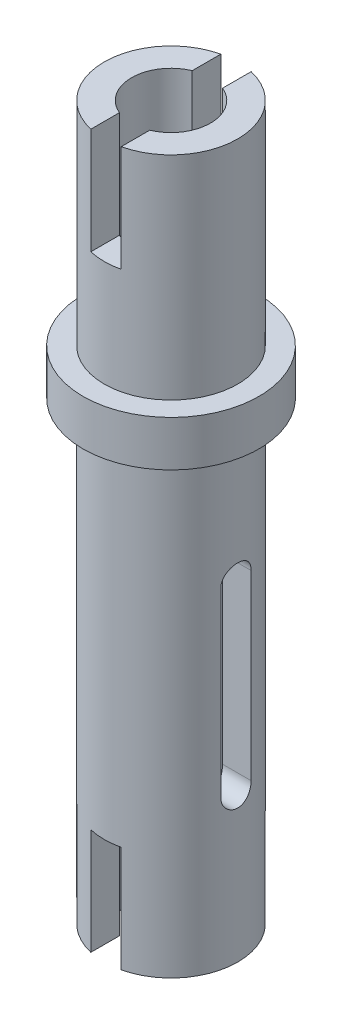
from build123d import *

# Parameters (mm, degrees)
SKETCH1_R           = 2.2
SKETCH1_R_2         = 1.3
BOSS_EXTRUDE1_DEPTH = 23.5
BOSS_EXTRUDE2_START = -1.5
SKETCH2_R           = 2.9
SKETCH2_R_2         = 2.2
BOSS_EXTRUDE2_DEPTH = 1.5
CUT_EXTRUDE1_START  = -3.5
CUT_EXTRUDE1_DEPTH  = 3.5
CUT_EXTRUDE2_DEPTH  = 3.5
CUT_EXTRUDE3_DEPTH  = 11.75


with BuildPart() as part:
    # Sketch1 → Boss-Extrude1 (new body)
    with BuildSketch(Plane(origin=(0, 0, 0), x_dir=(1, 0, 0), z_dir=(0, 1, 0))):
        with Locations(Location((0, 0, 0), (0, 0, 270))):
            Circle(SKETCH1_R)
        with Locations(Location((0, 0, 0), (0, 0, 270))):
            Circle(SKETCH1_R_2, mode=Mode.SUBTRACT)
    extrude(amount=BOSS_EXTRUDE1_DEPTH)

    # Sketch2 → Boss-Extrude2 (add)
    with BuildSketch(Plane(origin=(0, 16.5, 0), x_dir=(1, 0, 0), z_dir=(0, 1, 0)).offset(BOSS_EXTRUDE2_START)):
        with Locations(Location((0, 0, 0), (0, 0, 270))):
            Circle(SKETCH2_R)
        with Locations(Location((0, 0, 0), (0, 0, 270))):
            Circle(SKETCH2_R_2, mode=Mode.SUBTRACT)
    extrude(amount=BOSS_EXTRUDE2_DEPTH)

    # Sketch4 → Cut-Extrude1 (cut)
    with BuildSketch(Plane(origin=(0, 23.5, 0), x_dir=(1, 0, 0), z_dir=(0, 1, 0)).offset(CUT_EXTRUDE1_START)):
        with BuildLine():
            Line((-0.5, -1.2), (-0.5, -2.142428529))
            ThreePointArc((-0.5, -2.142428529), (0, -2.2), (0.5, -2.142428529))
            Line((0.5, -2.142428529), (0.5, -1.2))
            ThreePointArc((0.5, -1.2), (0, -1.3), (-0.5, -1.2))
        make_face()
        with BuildLine():
            ThreePointArc((0.5, 2.142428529), (0, 2.2), (-0.5, 2.142428529))
            Line((-0.5, 2.142428529), (-0.5, 1.2))
            ThreePointArc((-0.5, 1.2), (0, 1.3), (0.5, 1.2))
            Line((0.5, 1.2), (0.5, 2.142428529))
        make_face()
        with BuildLine():
            Line((-0.5, -1.2), (-0.5, -2.142428529))
            ThreePointArc((-0.5, -2.142428529), (0, -2.2), (0.5, -2.142428529))
            Line((0.5, -2.142428529), (0.5, -1.2))
            ThreePointArc((0.5, -1.2), (0, -1.3), (-0.5, -1.2))
        make_face()
        with BuildLine():
            ThreePointArc((0.5, 2.142428529), (0, 2.2), (-0.5, 2.142428529))
            Line((-0.5, 2.142428529), (-0.5, 1.2))
            ThreePointArc((-0.5, 1.2), (0, 1.3), (0.5, 1.2))
            Line((0.5, 1.2), (0.5, 2.142428529))
        make_face()
    extrude(amount=CUT_EXTRUDE1_DEPTH, mode=Mode.SUBTRACT)

    # Sketch5 → Cut-Extrude2 (cut)
    with BuildSketch(Plane.XZ):
        with BuildLine():
            ThreePointArc((0.5, 2.142428529), (0, 2.2), (-0.5, 2.142428529))
            Line((-0.5, 2.142428529), (-0.5, 1.2))
            ThreePointArc((-0.5, 1.2), (0, 1.3), (0.5, 1.2))
            Line((0.5, 1.2), (0.5, 2.142428529))
        make_face()
        with BuildLine():
            Line((-0.5, -1.2), (-0.5, -2.142428529))
            ThreePointArc((-0.5, -2.142428529), (0, -2.2), (0.5, -2.142428529))
            Line((0.5, -2.142428529), (0.5, -1.2))
            ThreePointArc((0.5, -1.2), (0, -1.3), (-0.5, -1.2))
        make_face()
        with BuildLine():
            ThreePointArc((0.5, 2.142428529), (0, 2.2), (-0.5, 2.142428529))
            Line((-0.5, 2.142428529), (-0.5, 1.2))
            ThreePointArc((-0.5, 1.2), (0, 1.3), (0.5, 1.2))
            Line((0.5, 1.2), (0.5, 2.142428529))
        make_face()
        with BuildLine():
            Line((-0.5, -1.2), (-0.5, -2.142428529))
            ThreePointArc((-0.5, -2.142428529), (0, -2.2), (0.5, -2.142428529))
            Line((0.5, -2.142428529), (0.5, -1.2))
            ThreePointArc((0.5, -1.2), (0, -1.3), (-0.5, -1.2))
        make_face()
    extrude(amount=-CUT_EXTRUDE2_DEPTH, mode=Mode.SUBTRACT)

    # Sketch6 → Cut-Extrude3 (cut, symmetric)
    with BuildSketch(Plane(origin=(0, 0, 0), x_dir=(0, 0, -1), z_dir=(1, 0, 0))):
        with BuildLine():
            Line((0.5, 10.9), (0.5, 4.9))
            ThreePointArc((0.5, 4.9), (0, 4.4), (-0.5, 4.9))
            Line((-0.5, 4.9), (-0.5, 10.9))
            ThreePointArc((-0.5, 10.9), (0, 11.4), (0.5, 10.9))
        make_face()
    extrude(amount=CUT_EXTRUDE3_DEPTH, both=True, mode=Mode.SUBTRACT)


solid = part.part
